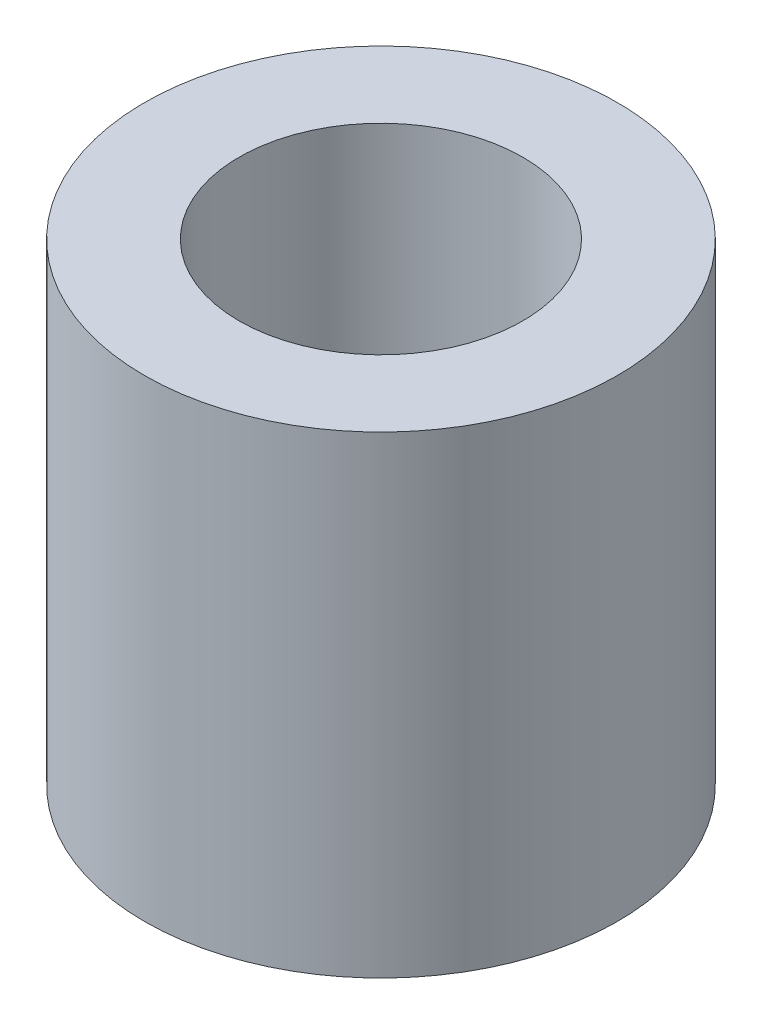
from build123d import *

# Parameters (mm, degrees)
ESQUISSE1_R      = 2.5
ESQUISSE1_R_2    = 1.5
EXTRUSION1_DEPTH = 2.5


with BuildPart() as part:
    # Esquisse1 → Extrusion1 (new, symmetric)
    with BuildSketch(Plane(origin=(0, 0, 0), x_dir=(1, 0, 0), z_dir=(0, 1, 0))):
        with Locations(Location((0, 0, 0), (0, 0, 270))):
            Circle(ESQUISSE1_R)
        with Locations(Location((0, 0, 0), (0, 0, 270))):
            Circle(ESQUISSE1_R_2, mode=Mode.SUBTRACT)
    extrude(amount=EXTRUSION1_DEPTH, both=True)


solid = part.part
